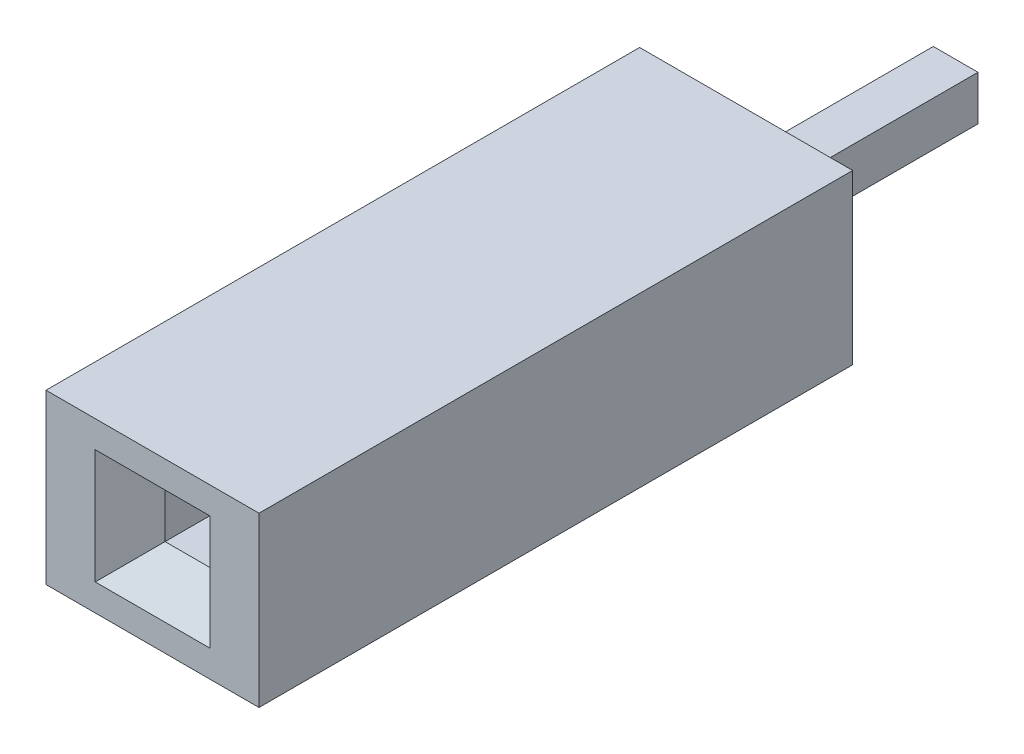
from build123d import *

# Parameters (mm, degrees)
SKETCH1_W           = 3.05
SKETCH1_H           = 2.41
BOSS_EXTRUDE1_DEPTH = 8.5
CUT_EXTRUDE1_START  = 8.5
SKETCH1_3_W         = 0.64
SKETCH1_3_H         = 0.64
CUT_EXTRUDE1_DEPTH  = 5
CHAMFER1_SIZE       = 0.5
SKETCH2_W           = 3.2
SKETCH2_H           = 0.64
BOSS_EXTRUDE2_DEPTH = 0.32
CHAMFER2_SIZE       = 0.2


with BuildPart() as part:
    # Sketch1 → Boss-Extrude1 (new body)
    with BuildSketch(Plane.XY):
        Rectangle(SKETCH1_W, SKETCH1_H)
    extrude(amount=BOSS_EXTRUDE1_DEPTH)

    # Sketch1<3> → Cut-Extrude1 (cut)
    with BuildSketch(Plane.XY.offset(CUT_EXTRUDE1_START)):
        Rectangle(SKETCH1_3_W, SKETCH1_3_H)
    extrude(amount=-CUT_EXTRUDE1_DEPTH, mode=Mode.SUBTRACT)

    # Chamfer1
    chamfer1_edges = [part.edges().sort_by_distance(p)[0] for p in [
        (-0.32, 0, 8.5),
        (0, -0.32, 8.5),
        (0.32, 0, 8.5),
        (0, 0.32, 8.5),
    ]]
    chamfer(chamfer1_edges, length=CHAMFER1_SIZE)

    # Sketch2 → Boss-Extrude2 (add, symmetric)
    with BuildSketch(Plane(origin=(0, 0, 0), x_dir=(0, 0, -1), z_dir=(1, 0, 0))):
        with Locations((1.6, 0)):
            Rectangle(SKETCH2_W, SKETCH2_H)
    extrude(amount=BOSS_EXTRUDE2_DEPTH, both=True)

    # Chamfer2
    chamfer2_edges = [part.edges().sort_by_distance(p)[0] for p in [
        (0.32, 0, -3.2),
        (0, -0.32, -3.2),
        (0, 0.32, -3.2),
        (-0.32, 0, -3.2),
    ]]
    chamfer(chamfer2_edges, length=CHAMFER2_SIZE)


solid = part.part
